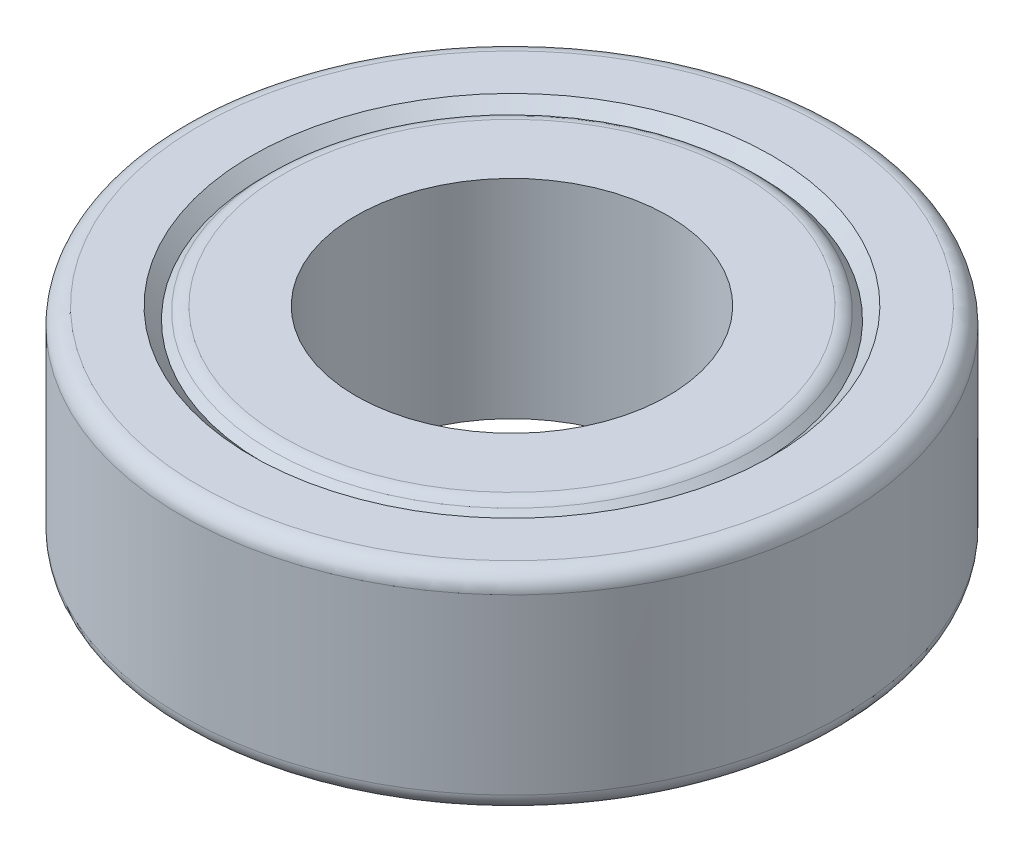
from build123d import *

# Parameters (mm, degrees)
CONG_2_R = 0.5
CONG_3_R = 0.5


with BuildPart() as part:
    # Esquisse1 → Révolution1 (revolve)
    with BuildSketch(Plane.XY, mode=Mode.PRIVATE) as r_volution1_sk:
        Polygon((-9.5, -3), (-9.5, 3), (-7.5, 3), (-7.146446609, 2.646446609), (-6.792893219, 3), (-4.5, 3), (-4.5, -3), (-6.792893219, -3), (-7.146446609, -2.646446609), (-7.5, -3), align=None)
    revolve(r_volution1_sk.sketch.rotate(Axis((0, 0, 0), (0, 1, 0)), 270), axis=Axis((0, 0, 0), (0, 1, 0)))

    # Congé2
    cong_2_edges = [part.edges().sort_by_distance(p)[0] for p in [
        (0, 3, 6.792893219),
        (0, -3, 6.792893219),
    ]]
    fillet(cong_2_edges, radius=CONG_2_R)

    # Congé3
    cong_3_edges = [part.edges().sort_by_distance(p)[0] for p in [
        (0, 3, 9.5),
        (0, -3, 9.5),
    ]]
    fillet(cong_3_edges, radius=CONG_3_R)


solid = part.part
